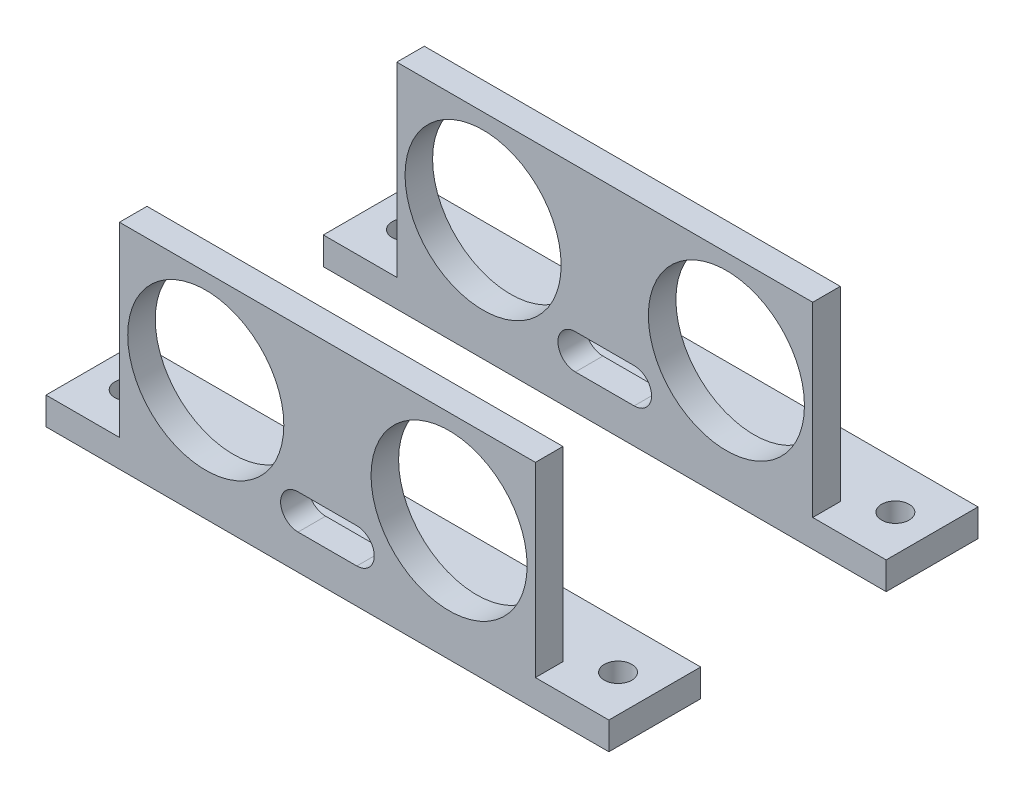
from build123d import *

# Parameters (mm, degrees)
SKETCH1_W               = 170
SKETCH1_H               = 3
BOSS_EXTRUDE1_DEPTH     = 10
SKETCH4_R               = 1.2
CUT_EXTRUDE1_DEPTH      = 21
SKETCH2_W               = 45.3
SKETCH2_H               = 3
BOSS_EXTRUDE6_DEPTH     = 20.3
SKETCH5_R               = 8.5
CUT_EXTRUDE2_DEPTH      = 20.3
SKETCH6_W               = 45.3
SKETCH6_H               = 3
BOSS_EXTRUDE7_DEPTH     = 20.3
SKETCH7_R               = 8.5
CUT_EXTRUDE3_DEPTH      = 100.885733504
CUT_EXTRUDE5_DEPTH      = 102.201856693
CUT_EXTRUDE5_DEPTH_BACK = 102.201856693
SKETCH12_W              = 88.7
SKETCH12_H              = 17.241657791
CUT_EXTRUDE6_DEPTH      = 75.862735481
CUT_EXTRUDE6_DEPTH_BACK = 75.862735481
SKETCH13_W              = 37.135878318
SKETCH13_H              = 38.462159687
SKETCH13_W_2            = 38.462159687
SKETCH13_H_2            = 47.746129266
SKETCH15_W              = 8
SKETCH15_H              = 10
BOSS_EXTRUDE9_DEPTH     = 3
CUT_EXTRUDE7_DEPTH      = 67.392895801
CUT_EXTRUDE7_DEPTH_BACK = 67.392895801
SKETCH16_R              = 1.5


with BuildPart() as part:
    # Sketch1 → Boss-Extrude1 (new body)
    with BuildSketch(Plane.XY):
        with Locations((13.639372454, -9.657761352)):
            Rectangle(SKETCH1_W, SKETCH1_H)
    extrude(amount=BOSS_EXTRUDE1_DEPTH)

    # Sketch4 → Cut-Extrude1 (cut)
    with BuildSketch(Plane(origin=(0, -8.157761352, 0), x_dir=(1, 0, 0), z_dir=(0, 1, 0))):
        with Locations(Location((-63.360627546, -4.938536908, 0), (0, 0, 180))):
            Circle(SKETCH4_R)
        with Locations(Location((90.639372454, -5.283238547, 0), (0, 0, 180))):
            Circle(SKETCH4_R)
    extrude(amount=-CUT_EXTRUDE1_DEPTH, mode=Mode.SUBTRACT)

    # Sketch2 → Boss-Extrude6 (add)
    with BuildSketch(Plane(origin=(0, -8.157761352, 0), x_dir=(1, 0, 0), z_dir=(0, 1, 0))):
        with Locations((-30.710627546, -8.5)):
            Rectangle(SKETCH2_W, SKETCH2_H)
    extrude(amount=BOSS_EXTRUDE6_DEPTH)

    # Sketch5 → Cut-Extrude2 (cut)
    with BuildSketch(Plane(origin=(0, 0, 7), x_dir=(-1, 0, 0), z_dir=(0, 0, -1))):
        with Locations((17.460627546, 1.942238648)):
            Circle(SKETCH5_R)
        with Locations((43.960627546, 1.942238648)):
            Circle(SKETCH5_R)
        with BuildLine():
            Line((27.510627546, -3.557761352), (33.910627546, -3.557761352))
            ThreePointArc((33.910627546, -3.557761352), (35.810627546, -5.457761352), (33.910627546, -7.357761352))
            Line((33.910627546, -7.357761352), (27.510627546, -7.357761352))
            ThreePointArc((27.510627546, -7.357761352), (25.610627546, -5.457761352), (27.510627546, -3.557761352))
        make_face()
    extrude(amount=-CUT_EXTRUDE2_DEPTH, mode=Mode.SUBTRACT)

    # Sketch6 → Boss-Extrude7 (add)
    with BuildSketch(Plane(origin=(0, -8.157761352, 0), x_dir=(1, 0, 0), z_dir=(0, 1, 0))):
        with Locations((57.989372454, -8.5)):
            Rectangle(SKETCH6_W, SKETCH6_H)
    extrude(amount=BOSS_EXTRUDE7_DEPTH)

    # Sketch7 → Cut-Extrude3 (cut, through all)
    with BuildSketch(Plane.XY.offset(10)):
        with Locations((44.739372454, 1.942238648)):
            Circle(SKETCH7_R)
        with Locations((71.239372454, 1.942238648)):
            Circle(SKETCH7_R)
        with BuildLine():
            Line((54.839372454, -3.557761352), (61.239372454, -3.557761352))
            ThreePointArc((61.239372454, -3.557761352), (63.139372454, -5.457761352), (61.239372454, -7.357761352))
            Line((61.239372454, -7.357761352), (54.839372454, -7.357761352))
            ThreePointArc((54.839372454, -7.357761352), (52.939372454, -5.457761352), (54.839372454, -3.557761352))
        make_face()
    extrude(amount=-CUT_EXTRUDE3_DEPTH, mode=Mode.SUBTRACT)

    # Sketch12 → Cut-Extrude5 (cut, two sides: drawn at the far end of the back side and taken through both)
    with BuildSketch(Plane(origin=(0, -8.157761352, 0), x_dir=(1, 0, 0), z_dir=(0, 1, 0)).offset(-CUT_EXTRUDE5_DEPTH_BACK)):
        with Locations((54.289372454, -4.61843826)):
            Rectangle(SKETCH12_W, SKETCH12_H)
    extrude(amount=CUT_EXTRUDE5_DEPTH + CUT_EXTRUDE5_DEPTH_BACK, mode=Mode.SUBTRACT)

    # Sketch13 → Cut-Extrude6 (cut, two sides: drawn at the far end of the back side and taken through both)
    with BuildSketch(Plane(origin=(0, -8.157761352, 0), x_dir=(1, 0, 0), z_dir=(0, 1, 0)).offset(-CUT_EXTRUDE6_DEPTH_BACK)):
        with Locations((-71.928566705, 3.983905185)):
            Rectangle(SKETCH13_W, SKETCH13_H)
        with Locations((11.170452297, -17.070811541)):
            Rectangle(SKETCH13_W_2, SKETCH13_H_2)
    extrude(amount=CUT_EXTRUDE6_DEPTH + CUT_EXTRUDE6_DEPTH_BACK, mode=Mode.SUBTRACT)

    # Sketch15 → Boss-Extrude9 (add)
    with BuildSketch(Plane.XZ.offset(11.157761352)):
        with Locations((-57.360627546, 5)):
            Rectangle(SKETCH15_W, SKETCH15_H)
        with Locations((-4.060627546, 5)):
            Rectangle(SKETCH15_W, SKETCH15_H)
    extrude(amount=-BOSS_EXTRUDE9_DEPTH)

    # Sketch16 → Cut-Extrude7 (cut, two sides: drawn at the far end of the back side and taken through both)
    with BuildSketch(Plane(origin=(0, -11.157761352, 0), x_dir=(-1, 0, 0), z_dir=(0, -1, 0)).offset(-CUT_EXTRUDE7_DEPTH_BACK)):
        with Locations(Location((57.360627546, -5, 0), (0, 0, 180))):
            Circle(SKETCH16_R)
        with Locations(Location((4.060627546, -5, 0), (0, 0, 180))):
            Circle(SKETCH16_R)
    extrude(amount=CUT_EXTRUDE7_DEPTH + CUT_EXTRUDE7_DEPTH_BACK, mode=Mode.SUBTRACT)


with BuildPart() as body_2:
    # Body-Move/Copy1: copy of part
    add(part.part.moved(Location((0, 0, -30.202366557))))


solid = Compound([part.part, body_2.part])
